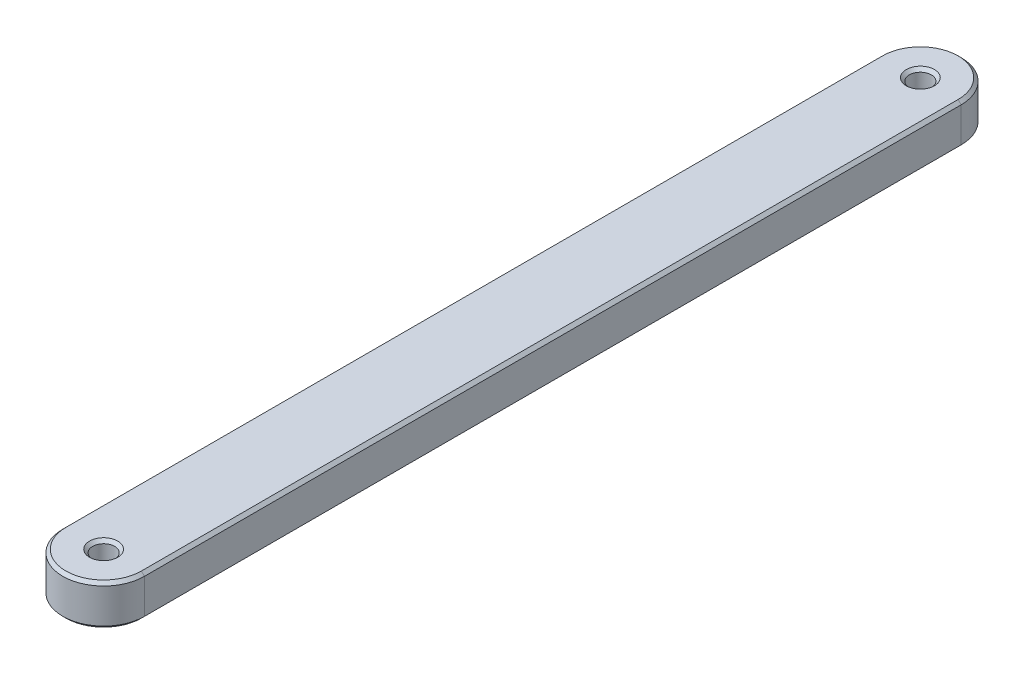
from build123d import *

# Parameters (mm, degrees)
SKETCH1_R           = 2.7
BOSS_EXTRUDE1_DEPTH = 10
SKETCH2_R           = 6.5
CUT_EXTRUDE1_DEPTH  = 4
CHAMFER1_SIZE       = 0.75


with BuildPart() as part:
    # Sketch1 → Boss-Extrude1 (new body)
    with BuildSketch(Plane(origin=(0, 0, 0), x_dir=(1, 0, 0), z_dir=(0, 1, 0))):
        with BuildLine():
            Line((10, -100), (10, 100))
            ThreePointArc((10, 100), (0, 110), (-10, 100))
            Line((-10, 100), (-10, -100))
            ThreePointArc((-10, -100), (0, -110), (10, -100))
        make_face()
        with Locations(Location((0, -100, 0), (0, 0, 270))):
            Circle(SKETCH1_R, mode=Mode.SUBTRACT)
        with Locations(Location((0, 100, 0), (0, 0, 270))):
            Circle(SKETCH1_R, mode=Mode.SUBTRACT)
    extrude(amount=BOSS_EXTRUDE1_DEPTH)

    # Sketch2 → Cut-Extrude1 (cut)
    with BuildSketch(Plane.XZ):
        with Locations(Location((0, 100, 0), (0, 0, 270))):
            Circle(SKETCH2_R)
        with Locations(Location((0, -100, 0), (0, 0, 270))):
            Circle(SKETCH2_R)
    extrude(amount=-CUT_EXTRUDE1_DEPTH, mode=Mode.SUBTRACT)

    # Chamfer1
    chamfer1_edges = [part.edges().sort_by_distance(p)[0] for p in [
        (0, 10, 97.3),
        (10, 10, 0),
        (0, 10, -110),
        (0, 4, 97.3),
        (0, 0, 106.5),
        (0, 0, -93.5),
        (0, 4, -102.7),
        (-10, 10, 0),
        (0, 10, 110),
        (0, 10, -102.7),
        (0, 0, 110),
        (-10, 0, 0),
        (0, 0, -110),
        (10, 0, 0),
    ]]
    chamfer(chamfer1_edges, length=CHAMFER1_SIZE)


solid = part.part
